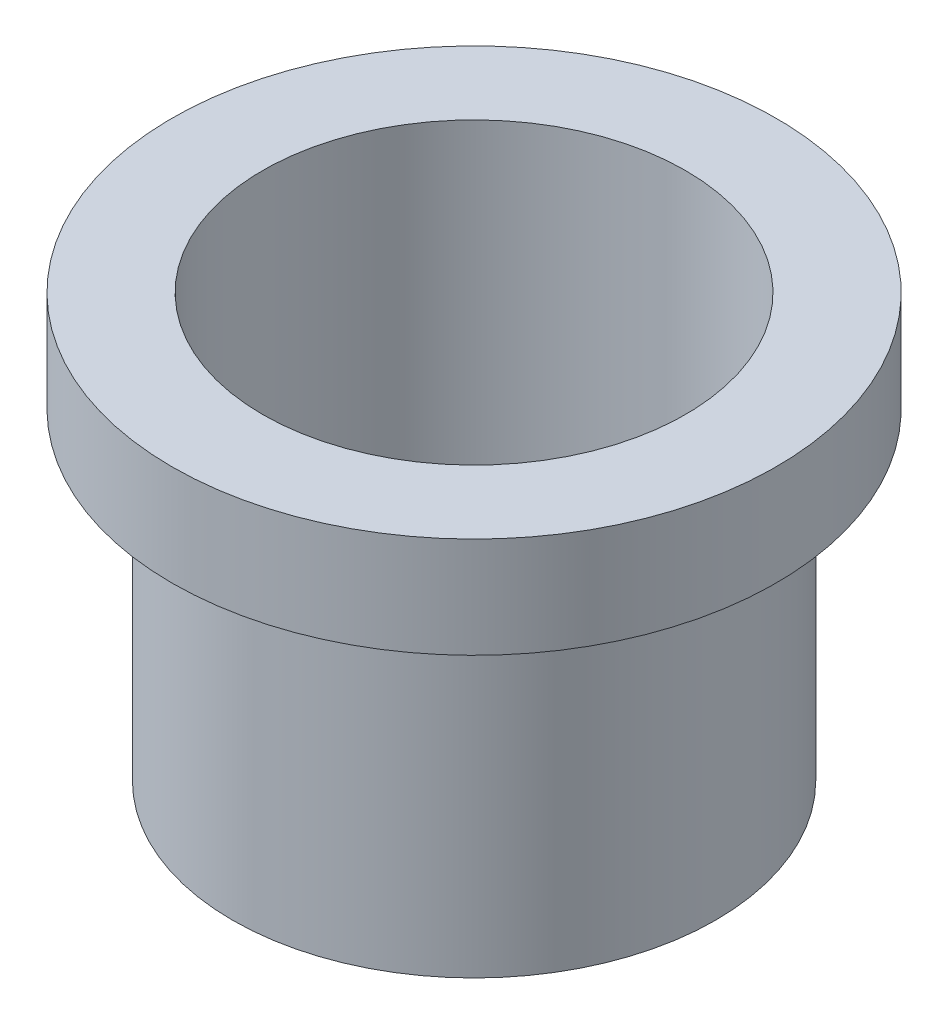
from build123d import *

# Parameters (mm, degrees)
SKETCH2_R          = 10.5
CUT_EXTRUDE2_DEPTH = 30.849623113


with BuildPart() as part:
    # Sketch1 → Revolve1 (revolve)
    with BuildSketch(Plane.XY, mode=Mode.PRIVATE) as revolve1_sk:
        Polygon((0, 21), (15, 21), (15, 16), (12, 16), (12, 0), (0, 0), align=None)
    revolve(revolve1_sk.sketch.rotate(Axis((0, 64.750503018, 0), (0, -1, 0)), 90), axis=Axis((0, 64.750503018, 0), (0, -1, 0)))

    # Sketch2 → Cut-Extrude2 (cut, through all)
    with BuildSketch(Plane(origin=(0, 21, 0), x_dir=(1, 0, 0), z_dir=(0, 1, 0))):
        with Locations(Location((0, 0, 0), (0, 0, 270))):
            Circle(SKETCH2_R)
    extrude(amount=-CUT_EXTRUDE2_DEPTH, mode=Mode.SUBTRACT)


solid = part.part
